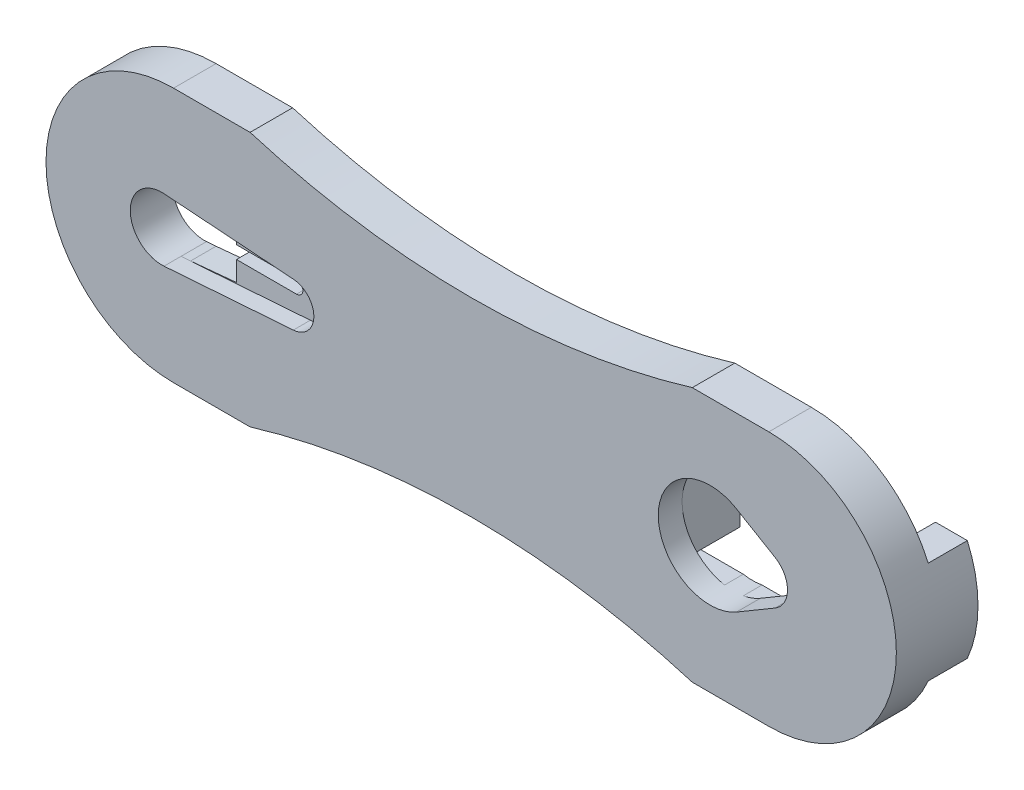
from build123d import *
from build123d.topology import SkipClean

# Parameters (mm, degrees)
BOSS_EXTRUDE1_DEPTH        = 5
CROQUIS3_W                 = 23
CROQUIS3_H                 = 12
CORTAR_EXTRUIR2_DEPTH      = 2.2
CORTAR_EXTRUIR3_DEPTH      = 91.182259896
CORTAR_EXTRUIR3_DEPTH_BACK = 91.182259896
CUT_EXTRUDE4_DEPTH         = 91.277350426
CUT_EXTRUDE4_DEPTH_BACK    = 2
CUT_EXTRUDE6_DEPTH         = 91.188691087
BOSS_EXTRUDE2_START        = 4.6
SKETCH9_W                  = 5
SKETCH9_H                  = 12
BOSS_EXTRUDE2_DEPTH        = 4.6
SKETCH10_R                 = 0.9
CUT_EXTRUDE7_DEPTH         = 8
CUT_EXTRUDE8_DEPTH         = 91.458609319


with BuildPart() as part:
    # Sketch1 → Boss-Extrude1 (new body)
    with BuildSketch(Plane(origin=(0, 0, 0), x_dir=(-1, 0, 0), z_dir=(0, 0, -1))):
        with BuildLine():
            Line((-70, 0), (-61, 0))
            ThreePointArc((-61, 0), (-35, -3.837363086), (-9, 0))
            Line((-9, 0), (0, 0))
            ThreePointArc((0, 0), (15, -15), (0, -30))
            Line((0, -30), (-9, -30))
            ThreePointArc((-9, -30), (-35, -26.162636914), (-61, -30))
            Line((-61, -30), (-70, -30))
            ThreePointArc((-70, -30), (-85, -15), (-70, 0))
        make_face()
        with BuildLine():
            Line((0, -11.4), (-5.4, -11.905))
            Line((-5.4, -11.905), (-5.4, -18.095))
            Line((-5.4, -18.095), (0, -18.6))
            ThreePointArc((0, -18.6), (3.6, -15), (0, -11.4))
        make_face(mode=Mode.SUBTRACT)
    extrude(amount=-BOSS_EXTRUDE1_DEPTH)

    # Croquis3 → Cortar-Extruir2 (cut)
    with BuildSketch(Plane(origin=(0, 0, 0), x_dir=(-1, 0, 0), z_dir=(0, 0, -1))):
        with Locations((-68.5, -15)):
            Rectangle(CROQUIS3_W, CROQUIS3_H)
    extrude(amount=-CORTAR_EXTRUIR2_DEPTH, mode=Mode.SUBTRACT)

    # Croquis4 → Cortar-Extruir3 (cut, two sides: drawn at the far end of the back side and taken through both)
    with BuildSketch(Plane(origin=(0, 0, 2.2), x_dir=(-1, 0, 0), z_dir=(0, 0, -1)).offset(-CORTAR_EXTRUIR3_DEPTH_BACK)):
        with BuildLine():
            Line((-66.2, -9.746429785), (-70.724590164, -12.416276944))
            ThreePointArc((-70.724590164, -12.416276944), (-72.2, -15), (-70.724590164, -17.583723056))
            Line((-70.724590164, -17.583723056), (-66.2, -20.253570215))
            ThreePointArc((-66.2, -20.253570215), (-57, -15), (-66.2, -9.746429785))
        make_face()
    extrude(amount=CORTAR_EXTRUIR3_DEPTH + CORTAR_EXTRUIR3_DEPTH_BACK, mode=Mode.SUBTRACT)

    # Sketch6 → Cut-Extrude4 (cut, two sides: drawn at the far end of the back side and taken through both)
    with BuildSketch(Plane.XY.offset(5).offset(-CUT_EXTRUDE4_DEPTH_BACK)):
        with BuildLine():
            Line((14.08705036, -12.406737159), (-1.12381295, -11.309587495))
            ThreePointArc((-1.12381295, -11.309587495), (-5.09, -15), (-1.12381295, -18.690412505))
            Line((-1.12381295, -18.690412505), (14.08705036, -17.593262841))
            ThreePointArc((14.08705036, -17.593262841), (16.5, -15), (14.08705036, -12.406737159))
        make_face()
    extrude(amount=CUT_EXTRUDE4_DEPTH + CUT_EXTRUDE4_DEPTH_BACK, mode=Mode.SUBTRACT)

    # Sketch8 → Cut-Extrude6 (cut, through all)
    with SkipClean():  # the faces are left unmerged after this step: merging them gives an invalid solid
        with BuildSketch(Plane.XY.offset(3)):
            with BuildLine():
                Line((-1.12381295, -11.309587495), (0, -11.4))
                ThreePointArc((0, -11.4), (-3.6, -15), (0, -18.6))
                Line((0, -18.6), (-1.12381295, -18.690412505))
                ThreePointArc((-1.12381295, -18.690412505), (-5.09, -15), (-1.12381295, -11.309587495))
            make_face()
        extrude(amount=-CUT_EXTRUDE6_DEPTH, mode=Mode.SUBTRACT)

    # Sketch9 → Boss-Extrude2 (add)
    with SkipClean():  # the faces are left unmerged after this step: merging them gives an invalid solid
        with BuildSketch(Plane(origin=(0, 0, 0), x_dir=(-1, 0, 0), z_dir=(0, 0, -1)).offset(BOSS_EXTRUDE2_START)):
            with BuildLine():
                Line((-83.747727085, -21), (-80, -21))
                Line((-80, -21), (-80, -9))
                Line((-80, -9), (-83.747727085, -9))
                ThreePointArc((-83.747727085, -9), (-85, -15), (-83.747727085, -21))
            make_face()
            with Locations((-54.5, -15)):
                Rectangle(SKETCH9_W, SKETCH9_H)
        extrude(amount=-BOSS_EXTRUDE2_DEPTH)

    # Sketch10 → Cut-Extrude7 (cut)
    with SkipClean():  # the faces are left unmerged after this step: merging them gives an invalid solid
        with BuildSketch(Plane(origin=(0, 0, -4.6), x_dir=(-1, 0, 0), z_dir=(0, 0, -1))):
            with Locations((-54.44, -15)):
                Circle(SKETCH10_R)
            with Locations(Location((-82.56, -15, 0), (0, 0, 180))):
                Circle(SKETCH10_R)
        extrude(amount=-CUT_EXTRUDE7_DEPTH, mode=Mode.SUBTRACT)

    # Sketch11 → Cut-Extrude8 (cut, through all)
    with SkipClean():  # the faces are left unmerged after this step: merging them gives an invalid solid
        with BuildSketch(Plane.XY.offset(3)):
            with BuildLine():
                Line((4.96, -14.25), (12.46, -14.25))
                ThreePointArc((12.46, -14.25), (13.21, -15), (12.46, -15.75))
                Line((12.46, -15.75), (4.96, -15.75))
                Line((4.96, -15.75), (4.96, -14.25))
            make_face()
        extrude(amount=-CUT_EXTRUDE8_DEPTH, mode=Mode.SUBTRACT)


solid = part.part
